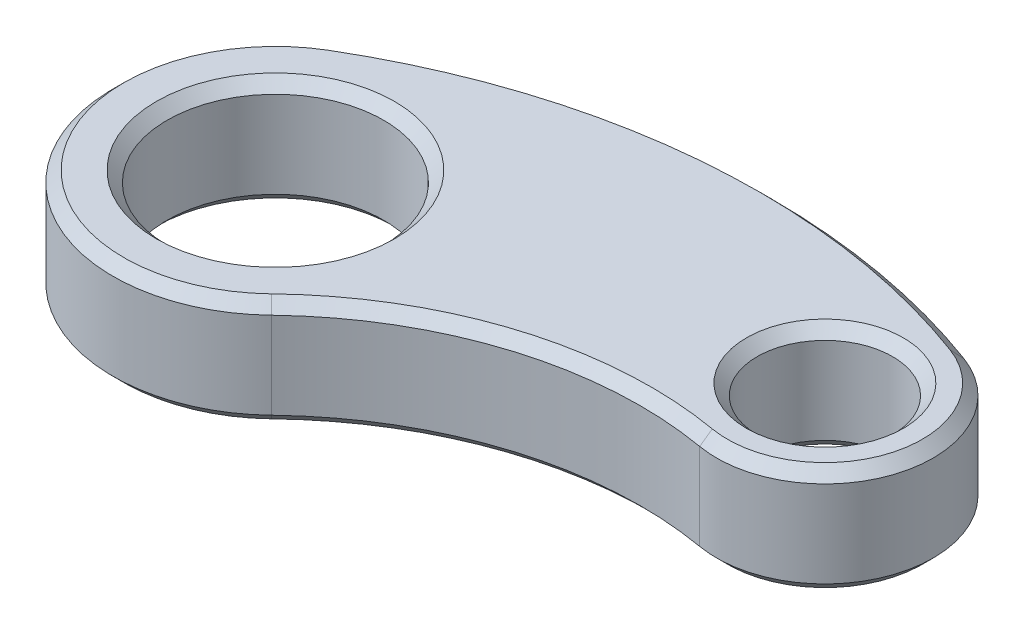
from build123d import *

# Parameters (mm, degrees)
CROQUIS2_R              = 20
CROQUIS2_R_2            = 12.5
SALIENTE_EXTRUIR1_DEPTH = 20
CHAFL_N1_SIZE           = 2


with BuildPart() as part:
    # Croquis2 → Saliente-Extruir1 (new body)
    with BuildSketch(Plane(origin=(0, 0, 0), x_dir=(1, 0, 0), z_dir=(0, 1, 0))):
        with BuildLine():
            ThreePointArc((-15.269779386, 25.823126021), (-23.871178313, -18.170493828), (20.824407657, -21.59500048))
            ThreePointArc((20.824407657, -21.59500048), (48.893723191, -5.058826483), (81.407845118, -3.018385264))
            ThreePointArc((81.407845118, -3.018385264), (104.144121582, 11.476569523), (91.783061927, 35.440003874))
            ThreePointArc((91.783061927, 35.440003874), (37.170213372, 42.72542693), (-15.269779386, 25.823126021))
        make_face()
        with Locations(Location((0, 0, 0), (0, 0, 270))):
            Circle(CROQUIS2_R, mode=Mode.SUBTRACT)
        with Locations(Location((84.83446024, 16.68588607, 0), (0, 0, 270))):
            Circle(CROQUIS2_R_2, mode=Mode.SUBTRACT)
    extrude(amount=SALIENTE_EXTRUIR1_DEPTH)

    # Chaflán1
    chafl_n1_edges = [part.edges().sort_by_distance(p)[0] for p in [
        (0, 0, -20),
        (0, 20, -20),
        (37.170213372, 20, -42.72542693),
        (84.83446024, 0, -29.18588607),
        (84.83446024, 20, -29.18588607),
        (-23.871178313, 20, 18.170493828),
        (48.893723191, 20, 5.058826483),
        (-23.871178313, 0, 18.170493828),
        (37.170213372, 0, -42.72542693),
        (104.144121582, 0, -11.476569523),
        (48.893723191, 0, 5.058826483),
        (104.144121582, 20, -11.476569523),
    ]]
    chamfer(chafl_n1_edges, length=CHAFL_N1_SIZE)


solid = part.part
